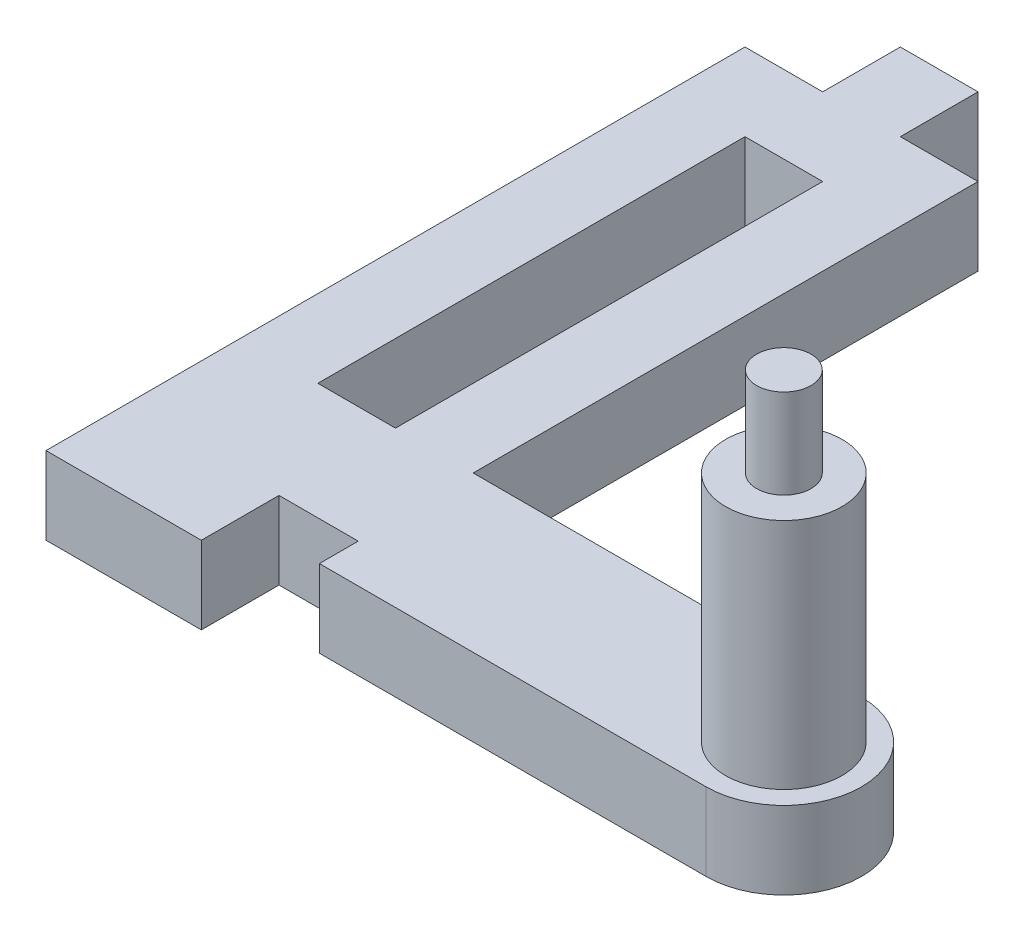
from build123d import *

# Parameters (mm, degrees)
SKETCH2_W           = 5
SKETCH2_H           = 27.5
BOSS_EXTRUDE1_DEPTH = 5
SKETCH3_R           = 3.75
BOSS_EXTRUDE2_DEPTH = 15
SKETCH4_R           = 1.75
BOSS_EXTRUDE3_DEPTH = 5.75


with BuildPart() as part:
    # Sketch2 → Boss-Extrude1 (new body)
    with BuildSketch(Plane(origin=(0, 0, 0), x_dir=(1, 0, 0), z_dir=(0, 1, 0))):
        with BuildLine():
            Line((0, 40), (0, -5))
            Line((0, -5), (10, -5))
            Line((10, -5), (10, 0))
            Line((10, 0), (15.1, 0))
            Line((15.1, 0), (15.1, -2.5))
            Line((15.1, -2.5), (40, -2.5))
            ThreePointArc((40, -2.5), (45, 2.5), (40, 7.5))
            Line((40, 7.5), (15, 7.5))
            Line((15, 7.5), (15, 21.207579156))
            Line((15, 21.207579156), (15, 40))
            Line((15, 40), (10, 40))
            Line((10, 40), (10, 45))
            Line((10, 45), (5, 45))
            Line((5, 45), (5, 40))
            Line((5, 40), (0, 40))
        make_face()
        with Locations((7.5, 21.25)):
            Rectangle(SKETCH2_W, SKETCH2_H, mode=Mode.SUBTRACT)
    extrude(amount=BOSS_EXTRUDE1_DEPTH)

    # Sketch3 → Boss-Extrude2 (add)
    with BuildSketch(Plane(origin=(0, 5, 0), x_dir=(1, 0, 0), z_dir=(0, 1, 0))):
        with Locations(Location((40, 2.5, 0), (0, 0, 270))):
            Circle(SKETCH3_R)
    extrude(amount=BOSS_EXTRUDE2_DEPTH)

    # Sketch4 → Boss-Extrude3 (add)
    with BuildSketch(Plane(origin=(0, 20, 0), x_dir=(1, 0, 0), z_dir=(0, 1, 0))):
        with Locations(Location((40, 2.5, 0), (0, 0, 270))):
            Circle(SKETCH4_R)
    extrude(amount=BOSS_EXTRUDE3_DEPTH)


solid = part.part
